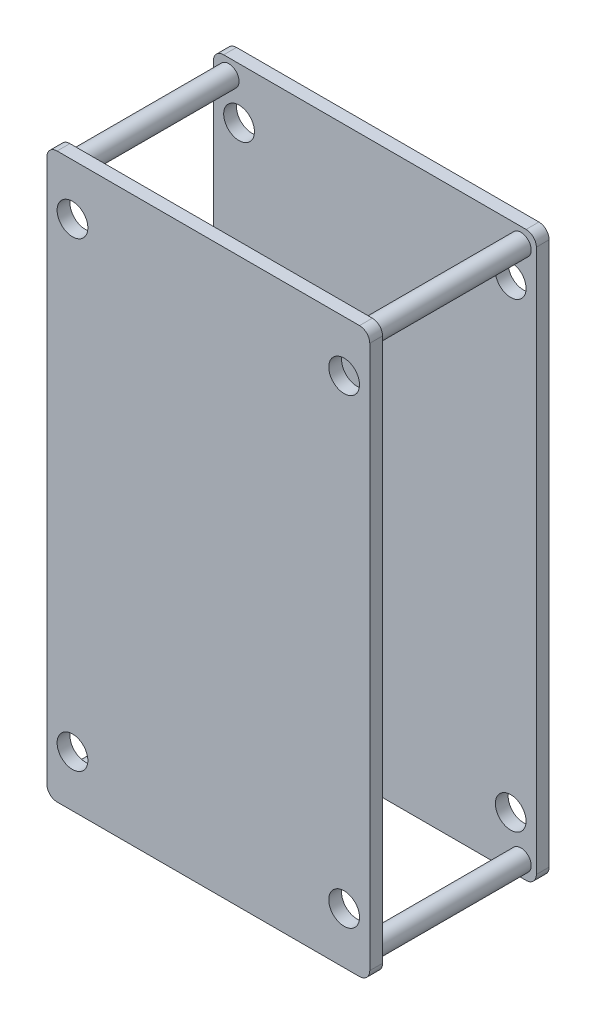
from build123d import *

# Parameters (mm, degrees)
SKETCH1_W           = 63
SKETCH1_H           = 110
SKETCH1_R           = 3
BOSS_EXTRUDE1_DEPTH = 2.5
SKETCH3_R           = 2
BOSS_EXTRUDE3_DEPTH = 30
FILLET2_R           = 2
FILLET3_R           = 2
FILLET4_R           = 2
FILLET5_R           = 2
SKETCH5_W           = 63
SKETCH5_H           = 110
SKETCH5_R           = 3
BOSS_EXTRUDE5_DEPTH = 2.5
FILLET10_R          = 2
FILLET11_R          = 2
FILLET12_R          = 2
FILLET13_R          = 2


with BuildPart() as part:
    # Sketch1 → Boss-Extrude1 (new body)
    with BuildSketch(Plane.XY):
        Rectangle(SKETCH1_W, SKETCH1_H)
        with Locations((-26.5, 45)):
            Circle(SKETCH1_R, mode=Mode.SUBTRACT)
        with Locations((-26.5, -45)):
            Circle(SKETCH1_R, mode=Mode.SUBTRACT)
        with Locations((26.5, -45)):
            Circle(SKETCH1_R, mode=Mode.SUBTRACT)
        with Locations((26.5, 45)):
            Circle(SKETCH1_R, mode=Mode.SUBTRACT)
    extrude(amount=BOSS_EXTRUDE1_DEPTH)

    # Sketch3 → Boss-Extrude3 (add)
    with BuildSketch(Plane.XY.offset(2.5)):
        with Locations(Location((-28.5, 52, 0), (0, 0, 180))):
            Circle(SKETCH3_R)
        with Locations(Location((28.5, 52, 0), (0, 0, 180))):
            Circle(SKETCH3_R)
        with Locations(Location((28.5, -52, 0), (0, 0, 180))):
            Circle(SKETCH3_R)
        with Locations(Location((-28.5, -52, 0), (0, 0, 180))):
            Circle(SKETCH3_R)
    extrude(amount=BOSS_EXTRUDE3_DEPTH)

    # Fillet2
    fillet2_edges = [part.edges().sort_by_distance(p)[0] for p in [
        (31.5, -55, 1.25),
    ]]
    fillet(fillet2_edges, radius=FILLET2_R)

    # Fillet3
    fillet3_edges = [part.edges().sort_by_distance(p)[0] for p in [
        (31.5, 55, 1.25),
    ]]
    fillet(fillet3_edges, radius=FILLET3_R)

    # Fillet4
    fillet4_edges = [part.edges().sort_by_distance(p)[0] for p in [
        (-31.5, 55, 1.25),
    ]]
    fillet(fillet4_edges, radius=FILLET4_R)

    # Fillet5
    fillet5_edges = [part.edges().sort_by_distance(p)[0] for p in [
        (-31.5, -55, 1.25),
    ]]
    fillet(fillet5_edges, radius=FILLET5_R)

    # Sketch5 → Boss-Extrude5 (add)
    with BuildSketch(Plane.XY.offset(32.5)):
        Rectangle(SKETCH5_W, SKETCH5_H)
        with Locations((-26.5, 45)):
            Circle(SKETCH5_R, mode=Mode.SUBTRACT)
        with Locations((-26.5, -45)):
            Circle(SKETCH5_R, mode=Mode.SUBTRACT)
        with Locations((26.5, -45)):
            Circle(SKETCH5_R, mode=Mode.SUBTRACT)
        with Locations((26.5, 45)):
            Circle(SKETCH5_R, mode=Mode.SUBTRACT)
    extrude(amount=BOSS_EXTRUDE5_DEPTH)

    # Fillet10
    fillet10_edges = [part.edges().sort_by_distance(p)[0] for p in [
        (31.5, 55, 33.75),
    ]]
    fillet(fillet10_edges, radius=FILLET10_R)

    # Fillet11
    fillet11_edges = [part.edges().sort_by_distance(p)[0] for p in [
        (31.5, -55, 33.75),
    ]]
    fillet(fillet11_edges, radius=FILLET11_R)

    # Fillet12
    fillet12_edges = [part.edges().sort_by_distance(p)[0] for p in [
        (-31.5, -55, 33.75),
    ]]
    fillet(fillet12_edges, radius=FILLET12_R)

    # Fillet13
    fillet13_edges = [part.edges().sort_by_distance(p)[0] for p in [
        (-31.5, 55, 33.75),
    ]]
    fillet(fillet13_edges, radius=FILLET13_R)


solid = part.part
